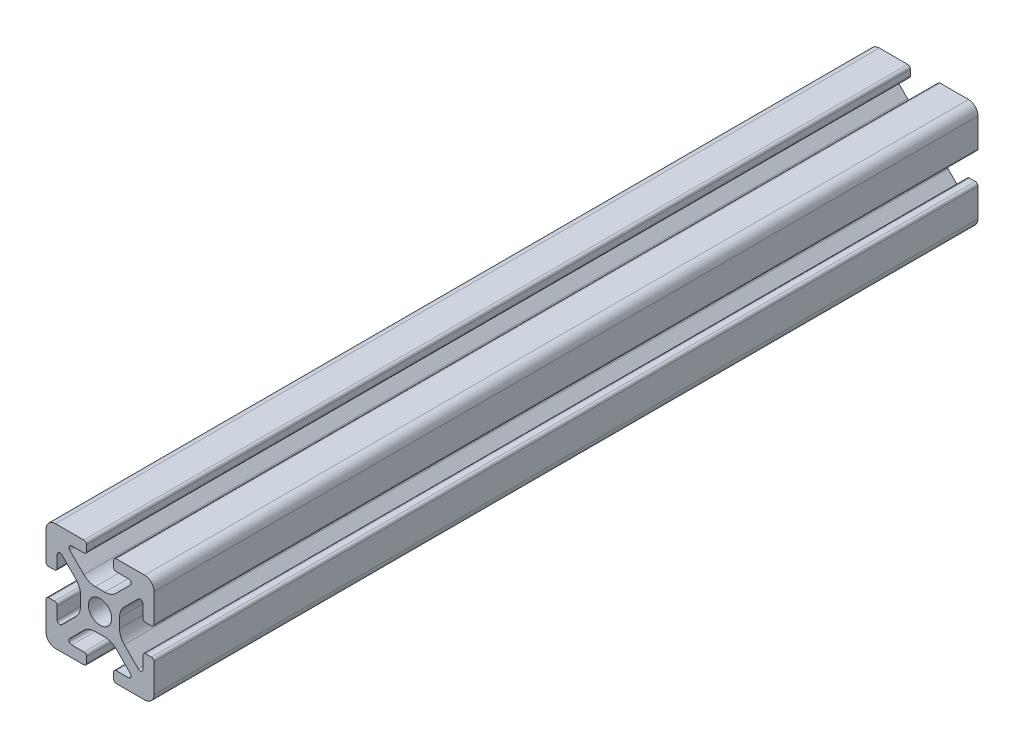
from build123d import *

# Parameters (mm, degrees)
BOSS_EXTRUDE1_DEPTH = 76.2


with BuildPart() as part:
    # Sketch4 → Boss-Extrude1 (new, symmetric)
    with BuildSketch(Plane.XY):
        with BuildLine():
            Line((3, -10), (8.25, -10))
            ThreePointArc((8.25, -10), (9.487436867, -9.487436867), (10, -8.25))
            Line((10, -8.25), (10, -3))
            ThreePointArc((10, -3), (9.853553391, -2.646446609), (9.5, -2.5))
            Line((9.5, -2.5), (8.424621202, -2.5))
            ThreePointArc((8.424621202, -2.5), (8.071067812, -2.646446609), (7.924621202, -3))
            Line((7.924621202, -3), (7.924621202, -5.25))
            ThreePointArc((7.924621202, -5.25), (7.615962919, -5.711939766), (7.071067812, -5.603553391))
            Line((7.071067812, -5.603553391), (4.478679656, -3.011165235))
            ThreePointArc((4.478679656, -3.011165235), (3.828361402, -2.037895189), (3.6, -0.889844892))
            Line((3.6, -0.889844892), (3.6, 0))
            Line((3.6, 0), (2.15, 0))
            ThreePointArc((2.15, 0), (1.52027958, -1.52027958), (0, -2.15))
            Line((0, -2.15), (0, -3.6))
            Line((0, -3.6), (0.889844892, -3.6))
            ThreePointArc((0.889844892, -3.6), (2.037895189, -3.828361402), (3.011165235, -4.478679656))
            Line((3.011165235, -4.478679656), (5.603553391, -7.071067812))
            ThreePointArc((5.603553391, -7.071067812), (5.711939766, -7.615962919), (5.25, -7.924621202))
            Line((5.25, -7.924621202), (3, -7.924621202))
            ThreePointArc((3, -7.924621202), (2.646446609, -8.071067812), (2.5, -8.424621202))
            Line((2.5, -8.424621202), (2.5, -9.5))
            ThreePointArc((2.5, -9.5), (2.646446609, -9.853553391), (3, -10))
        make_face()
    extrude(amount=BOSS_EXTRUDE1_DEPTH, both=True)

    # Mirror1: part across plane


with BuildPart() as part_1:
    add(part.part)
    add(part.part.mirror(Plane(origin=(0, 0, 0), x_dir=(0, 0, 1), z_dir=(1, 0, 0))))

    # Mirror2: part across plane


with BuildPart() as part_2:
    add(part_1.part)
    add(part_1.part.mirror(Plane.ZX))


solid = part_2.part
